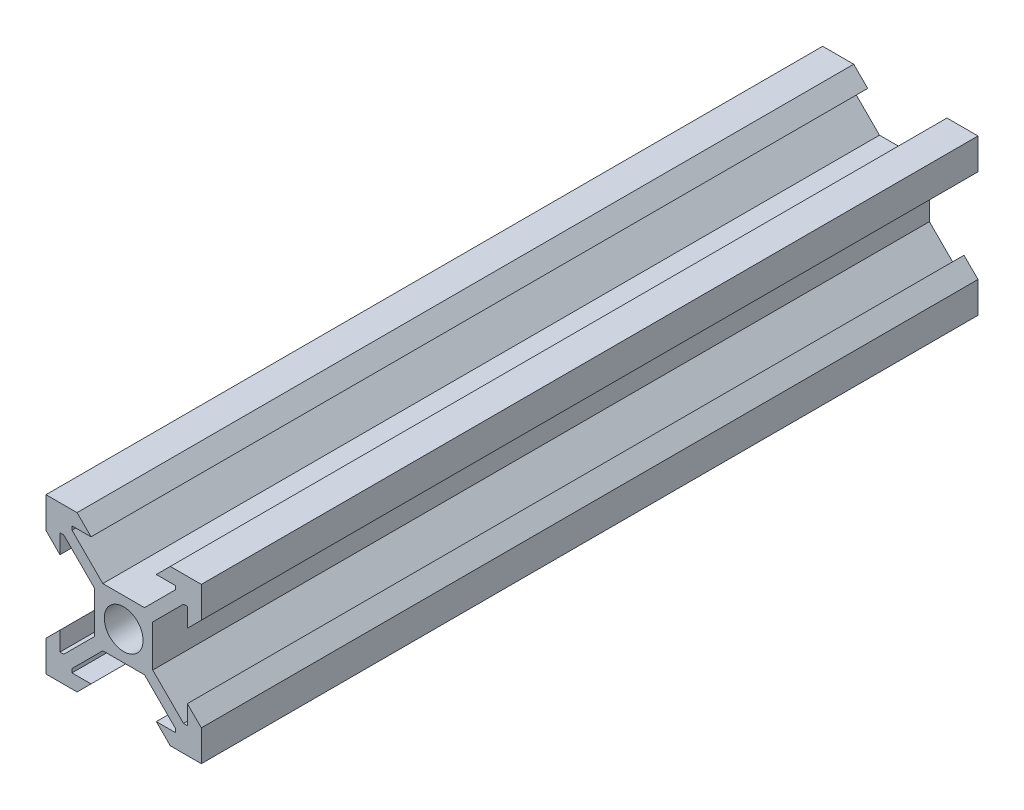
from build123d import *

# Parameters (mm, degrees)
SKETCH1_R           = 2.5
BOSS_EXTRUDE1_DEPTH = 100


with BuildPart() as part:
    # Sketch1 → Boss-Extrude1 (new body)
    with BuildSketch(Plane.XY):
        Polygon((-4.2, 8.2), (-6, 10), (-10, 10), (-10, 6), (-8.2, 4.2), (-8.2, 6.65), (-7.710660172, 6.65), (-3.744633983, 2.683973811), (-3.744633983, -2.683973811), (-7.710660172, -6.65), (-8.2, -6.65), (-8.2, -4.2), (-10, -6), (-10, -10), (-6, -10), (-4.2, -8.2), (-6.652632674, -8.2), (-6.652632674, -7.713292846), (-2.683973811, -3.744633983), (2.683973811, -3.744633983), (6.652632674, -7.713292846), (6.652632674, -8.2), (4.2, -8.2), (6, -10), (10, -10), (10, -6), (8.2, -4.2), (8.2, -6.65), (7.710660172, -6.65), (3.744633983, -2.683973811), (3.744633983, 2.683973811), (7.710660172, 6.65), (8.2, 6.65), (8.2, 4.2), (10, 6), (10, 10), (6, 10), (4.2, 8.2), (6.652632674, 8.2), (6.652632674, 7.713292846), (2.683973811, 3.744633983), (-2.683973811, 3.744633983), (-6.652632674, 7.713292846), (-6.652632674, 8.2), align=None)
        Circle(SKETCH1_R, mode=Mode.SUBTRACT)
    extrude(amount=BOSS_EXTRUDE1_DEPTH)


solid = part.part
